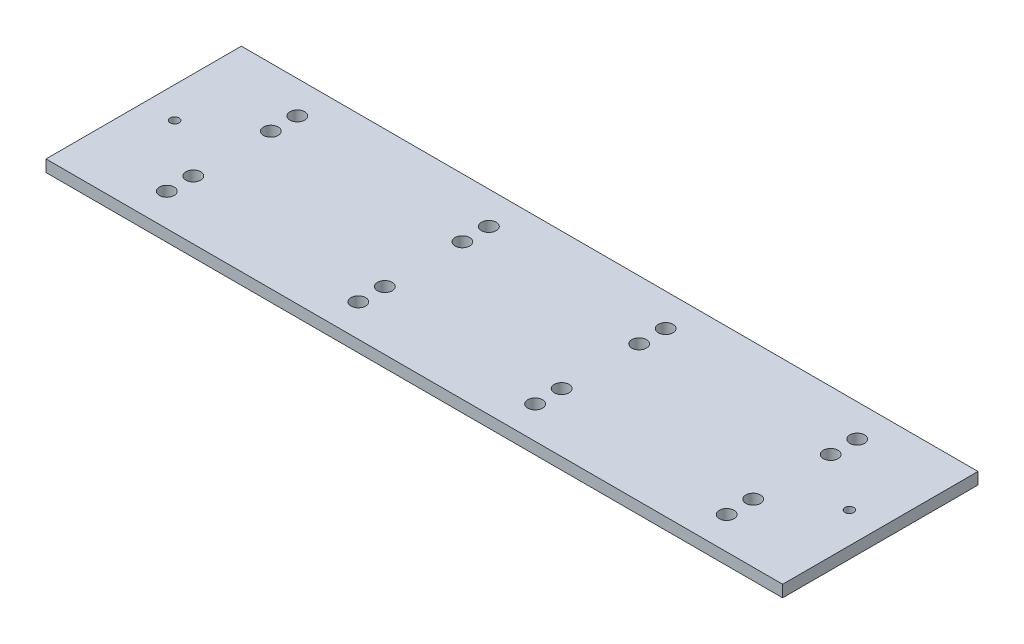
from build123d import *

# Parameters (mm, degrees)
SKETCH1_W                      = 250
SKETCH1_H                      = 66.3
BOSS_EXTRUDE1_DEPTH            = 4
F_5_0MM_DOWEL_HOLE2_AT_2_COUNT = 2
F_5_0MM_DOWEL_HOLE2_AT_2_PITCH = 9
LPATTERN2_COUNT                = 2
LPATTERN2_PITCH                = 65


with BuildPart() as part:
    # Sketch1 → Boss-Extrude1 (new body)
    with BuildSketch(Plane(origin=(0, 0, 0), x_dir=(1, 0, 0), z_dir=(0, 1, 0))):
        Rectangle(SKETCH1_W, SKETCH1_H)
    extrude(amount=BOSS_EXTRUDE1_DEPTH)

    # Sketch5 → Ø3.0mm Dowel Hole1 (revolve, cut)
    with BuildSketch(Plane(origin=(-114.5, 4, 0), x_dir=(0, 0, 1), z_dir=(1, 0, 0))):
        Polygon((0, 0), (0, 100.901290929), (1.5, 100), (1.5, 0), align=None)
    f_3_0mm_dowel_hole1 = revolve(axis=Axis((-114.5, 10.35, 0), (0, -1, 0)), mode=Mode.SUBTRACT)

    # Sketch7 → Ø5.0mm Dowel Hole2 (revolve, cut)
    with BuildSketch(Plane(origin=(-95, 4, -22.15), x_dir=(0, 0, 1), z_dir=(1, 0, 0))):
        Polygon((0, 0), (0, 51.502151548), (2.5, 50), (2.5, 0), align=None)
    f_5_0mm_dowel_hole2 = revolve(axis=Axis((-95, 10.35, -22.15), (0, -1, 0)), mode=Mode.SUBTRACT)

    # Ø5.0mm Dowel Hole2 at 2: Ø5.0mm Dowel Hole2 ×2
    with Locations(*[(0, 0, i * F_5_0MM_DOWEL_HOLE2_AT_2_PITCH) for i in range(1, F_5_0MM_DOWEL_HOLE2_AT_2_COUNT)]):
        add(f_5_0mm_dowel_hole2, mode=Mode.SUBTRACT)

    # LPattern2: Ø5.0mm Dowel Hole2 ×2
    with Locations(*[(i * LPATTERN2_PITCH, 0, 0) for i in range(1, LPATTERN2_COUNT)]):
        add(f_5_0mm_dowel_hole2, mode=Mode.SUBTRACT)

    # LPattern2 copy 1 sketch → LPattern2 copy 1 (revolve, cut)
    with BuildSketch(Plane(origin=(-30, 4, -13.15), x_dir=(0, 0, 1), z_dir=(1, 0, 0))):
        Polygon((0, 0), (0, 51.502151548), (2.5, 50), (2.5, 0), align=None)
    revolve(axis=Axis((-30, 10.35, -13.15), (0, -1, 0)), mode=Mode.SUBTRACT)

    # Mirror3: Ø3.0mm Dowel Hole1, Ø5.0mm Dowel Hole2 across plane
    add(f_3_0mm_dowel_hole1.mirror(Plane(origin=(0, 0, 0), x_dir=(0, 0, 1), z_dir=(1, 0, 0))), mode=Mode.SUBTRACT)
    add(f_5_0mm_dowel_hole2.mirror(Plane(origin=(0, 0, 0), x_dir=(0, 0, 1), z_dir=(1, 0, 0))), mode=Mode.SUBTRACT)

    # Mirror3 copy 1 sketch → Mirror3 copy 1 (revolve, cut)
    with BuildSketch(Plane(origin=(95, 4, -13.15), x_dir=(0, 0, 1), z_dir=(-1, 0, 0))):
        Polygon((0, 0), (0, -51.502151548), (2.5, -50), (2.5, 0), align=None)
    revolve(axis=Axis((95, 10.35, -13.15), (0, 1, 0)), mode=Mode.SUBTRACT)

    # Mirror3 copy 2 sketch → Mirror3 copy 2 (revolve, cut)
    with BuildSketch(Plane(origin=(30, 4, -22.15), x_dir=(0, 0, 1), z_dir=(-1, 0, 0))):
        Polygon((0, 0), (0, -51.502151548), (2.5, -50), (2.5, 0), align=None)
    revolve(axis=Axis((30, 10.35, -22.15), (0, 1, 0)), mode=Mode.SUBTRACT)

    # Mirror3 copy 3 sketch → Mirror3 copy 3 (revolve, cut)
    with BuildSketch(Plane(origin=(30, 4, -13.15), x_dir=(0, 0, 1), z_dir=(-1, 0, 0))):
        Polygon((0, 0), (0, -51.502151548), (2.5, -50), (2.5, 0), align=None)
    revolve(axis=Axis((30, 10.35, -13.15), (0, 1, 0)), mode=Mode.SUBTRACT)

    # Mirror4: Ø5.0mm Dowel Hole2 across plane
    add(f_5_0mm_dowel_hole2.mirror(Plane.XY), mode=Mode.SUBTRACT)

    # Mirror4 copy 1 sketch → Mirror4 copy 1 (revolve, cut)
    with BuildSketch(Plane(origin=(-95, 4, 13.15), x_dir=(0, 0, -1), z_dir=(1, 0, 0))):
        Polygon((0, 0), (0, -51.502151548), (2.5, -50), (2.5, 0), align=None)
    revolve(axis=Axis((-95, 10.35, 13.15), (0, 1, 0)), mode=Mode.SUBTRACT)

    # Mirror4 copy 2 sketch → Mirror4 copy 2 (revolve, cut)
    with BuildSketch(Plane(origin=(-30, 4, 22.15), x_dir=(0, 0, -1), z_dir=(1, 0, 0))):
        Polygon((0, 0), (0, -51.502151548), (2.5, -50), (2.5, 0), align=None)
    revolve(axis=Axis((-30, 10.35, 22.15), (0, 1, 0)), mode=Mode.SUBTRACT)

    # Mirror4 copy 3 sketch → Mirror4 copy 3 (revolve, cut)
    with BuildSketch(Plane(origin=(-30, 4, 13.15), x_dir=(0, 0, -1), z_dir=(1, 0, 0))):
        Polygon((0, 0), (0, -51.502151548), (2.5, -50), (2.5, 0), align=None)
    revolve(axis=Axis((-30, 10.35, 13.15), (0, 1, 0)), mode=Mode.SUBTRACT)

    # Mirror4 copy 4 sketch → Mirror4 copy 4 (revolve, cut)
    with BuildSketch(Plane(origin=(114.5, 4, 0), x_dir=(0, 0, -1), z_dir=(-1, 0, 0))):
        Polygon((0, 0), (0, 100.901290929), (1.5, 100), (1.5, 0), align=None)
    revolve(axis=Axis((114.5, 10.35, 0), (0, -1, 0)), mode=Mode.SUBTRACT)

    # Mirror4 copy 5 sketch → Mirror4 copy 5 (revolve, cut)
    with BuildSketch(Plane(origin=(95, 4, 22.15), x_dir=(0, 0, -1), z_dir=(-1, 0, 0))):
        Polygon((0, 0), (0, 51.502151548), (2.5, 50), (2.5, 0), align=None)
    revolve(axis=Axis((95, 10.35, 22.15), (0, -1, 0)), mode=Mode.SUBTRACT)

    # Mirror4 copy 6 sketch → Mirror4 copy 6 (revolve, cut)
    with BuildSketch(Plane(origin=(95, 4, 13.15), x_dir=(0, 0, -1), z_dir=(-1, 0, 0))):
        Polygon((0, 0), (0, 51.502151548), (2.5, 50), (2.5, 0), align=None)
    revolve(axis=Axis((95, 10.35, 13.15), (0, -1, 0)), mode=Mode.SUBTRACT)

    # Mirror4 copy 7 sketch → Mirror4 copy 7 (revolve, cut)
    with BuildSketch(Plane(origin=(30, 4, 22.15), x_dir=(0, 0, -1), z_dir=(-1, 0, 0))):
        Polygon((0, 0), (0, 51.502151548), (2.5, 50), (2.5, 0), align=None)
    revolve(axis=Axis((30, 10.35, 22.15), (0, -1, 0)), mode=Mode.SUBTRACT)

    # Mirror4 copy 8 sketch → Mirror4 copy 8 (revolve, cut)
    with BuildSketch(Plane(origin=(30, 4, 13.15), x_dir=(0, 0, -1), z_dir=(-1, 0, 0))):
        Polygon((0, 0), (0, 51.502151548), (2.5, 50), (2.5, 0), align=None)
    revolve(axis=Axis((30, 10.35, 13.15), (0, -1, 0)), mode=Mode.SUBTRACT)

    # Mirror4 copy 9 sketch → Mirror4 copy 9 (revolve, cut)
    with BuildSketch(Plane(origin=(-114.5, 4, 0), x_dir=(0, 0, -1), z_dir=(1, 0, 0))):
        Polygon((0, 0), (0, -100.901290929), (1.5, -100), (1.5, 0), align=None)
    revolve(axis=Axis((-114.5, 10.35, 0), (0, 1, 0)), mode=Mode.SUBTRACT)


solid = part.part
